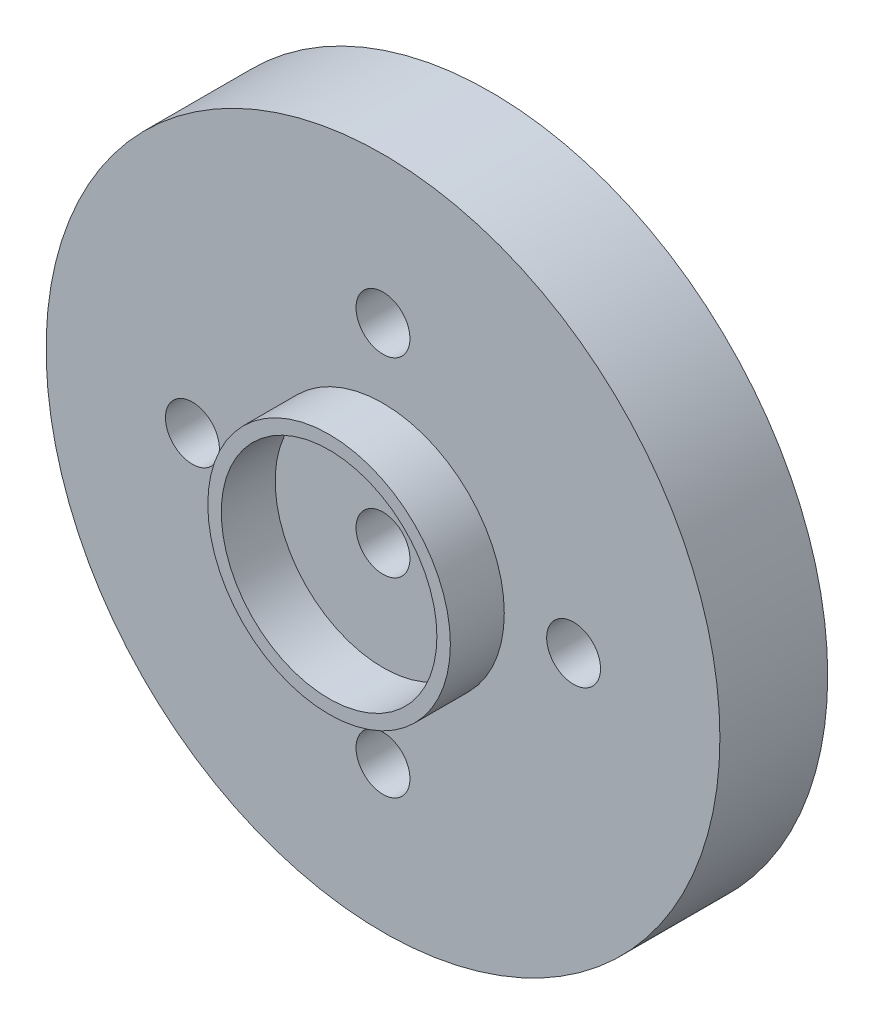
from build123d import *

# Parameters (mm, degrees)
SKETCH_1_R          = 12.5
EXTRUDE_1_DEPTH     = 4
SKETCH_2_R          = 4.5
EXTRUDE_2_DEPTH     = 2
SKETCH_3_R          = 1
CUT_EXTRUDE_3_DEPTH = 19.12456896
SKETCH_4_R          = 1
CUT_EXTRUDE_4_DEPTH = 19.668154703
SKETCH_5_R          = 4
CUT_EXTRUDE_5_DEPTH = 2
SKETCH_6_R          = 12.5
EXTRUDE_3_DEPTH     = 4
SKETCH_7_R          = 1
CUT_EXTRUDE_6_DEPTH = 4


with BuildPart() as part:
    # 草图1 → 凸台-拉伸1 (new body)
    with BuildSketch(Plane.XY):
        Circle(SKETCH_1_R)
    extrude(amount=EXTRUDE_1_DEPTH)

    # 草图2 → 凸台-拉伸2 (add)
    with BuildSketch(Plane.XY.offset(4)):
        Circle(SKETCH_2_R)
    extrude(amount=EXTRUDE_2_DEPTH)

    # 草图3 → 切除-拉伸3 (cut, through all)
    with BuildSketch(Plane.XY.offset(4)):
        with Locations((4.955921216, 5)):
            Circle(SKETCH_3_R)
        with Locations(Location((4.955921216, -5, 0), (0, 0, 180))):
            Circle(SKETCH_3_R)
        with Locations((-4.955921216, -5)):
            Circle(SKETCH_3_R)
        with Locations(Location((-4.955921216, 5, 0), (0, 0, 180))):
            Circle(SKETCH_3_R)
    extrude(amount=-CUT_EXTRUDE_3_DEPTH, mode=Mode.SUBTRACT)

    # 草图4 → 切除-拉伸4 (cut, through all)
    with BuildSketch(Plane.XY.offset(6)):
        Circle(SKETCH_4_R)
    extrude(amount=-CUT_EXTRUDE_4_DEPTH, mode=Mode.SUBTRACT)

    # 草图5 → 切除-拉伸5 (cut)
    with BuildSketch(Plane.XY.offset(6)):
        Circle(SKETCH_5_R)
    extrude(amount=-CUT_EXTRUDE_5_DEPTH, mode=Mode.SUBTRACT)

    # 草图6 → 凸台-拉伸3 (add)
    with BuildSketch(Plane(origin=(0, 0, 0), x_dir=(-1, 0, 0), z_dir=(0, 0, -1))):
        with Locations(Location((0, 0, 0), (0, 0, 180))):
            Circle(SKETCH_6_R)
    extrude(amount=-EXTRUDE_3_DEPTH)

    # 草图7 → 切除-拉伸6 (cut)
    with BuildSketch(Plane(origin=(0, 0, 0), x_dir=(-1, 0, 0), z_dir=(0, 0, -1))):
        with Locations((7.071067812, 0)):
            Circle(SKETCH_7_R)
        Circle(SKETCH_7_R)
        with Locations((0, 7.071067812)):
            Circle(SKETCH_7_R)
        with Locations((-7.071067812, 0)):
            Circle(SKETCH_7_R)
        with Locations((0, -7.071067812)):
            Circle(SKETCH_7_R)
    extrude(amount=-CUT_EXTRUDE_6_DEPTH, mode=Mode.SUBTRACT)


solid = part.part
